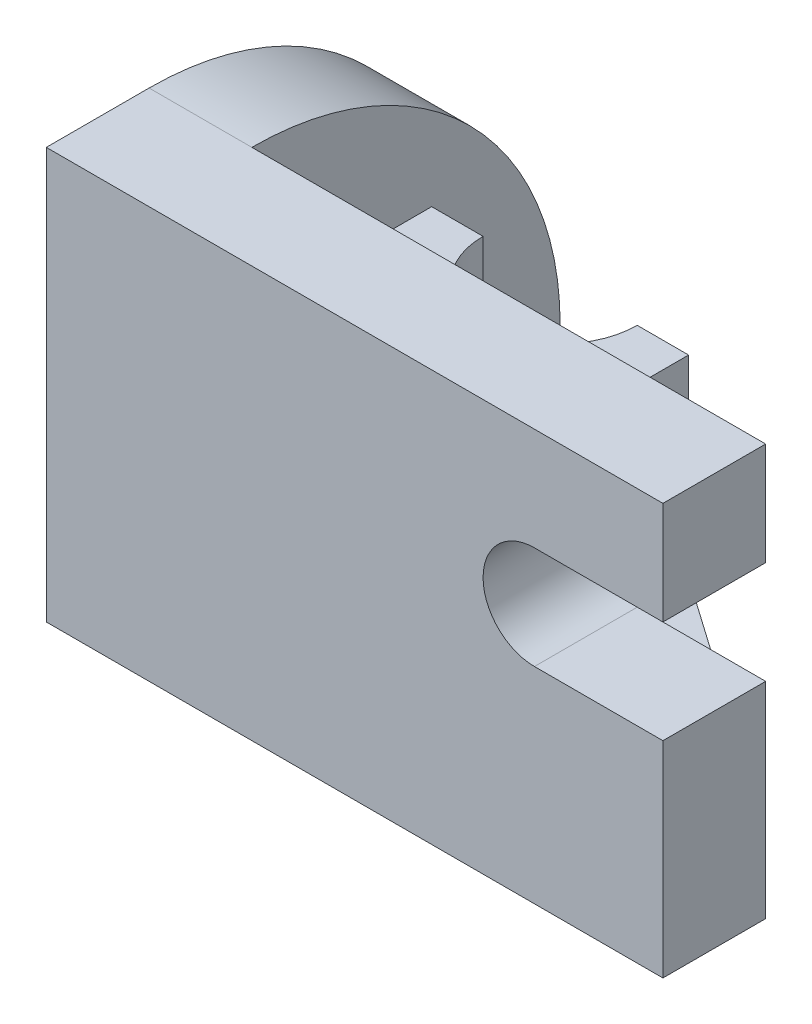
from build123d import *

# Parameters (mm, degrees)
SKETCH1_W           = 96
SKETCH1_H           = 64
BOSS_EXTRUDE1_DEPTH = 8
CUT_EXTRUDE1_DEPTH  = 60.866518188
SKETCH4_W           = 40
SKETCH4_H           = 28
BOSS_EXTRUDE2_DEPTH = 42
SKETCH5_R           = 12
CUT_EXTRUDE2_DEPTH  = 74.239333694
BOSS_EXTRUDE3_DEPTH = 12
BOSS_EXTRUDE4_DEPTH = 16


with BuildPart() as part:
    # Sketch1 → Boss-Extrude1 (new, symmetric)
    with BuildSketch(Plane.XY):
        Rectangle(SKETCH1_W, SKETCH1_H)
    extrude(amount=BOSS_EXTRUDE1_DEPTH, both=True)

    # Sketch2 → Cut-Extrude1 (cut, through all)
    with BuildSketch(Plane.XY.offset(8)):
        with BuildLine():
            Line((28, 0), (48, 0))
            Line((48, 0), (48, 16))
            Line((48, 16), (28, 16))
            ThreePointArc((28, 16), (33.656854249, 13.656854249), (36, 8))
            ThreePointArc((36, 8), (33.656854249, 2.343145751), (28, 0))
        make_face()
        with BuildLine():
            ThreePointArc((28, 16), (20, 8), (28, 0))
            Line((28, 0), (28, 16))
        make_face()
        with BuildLine():
            Line((28, 16), (28, 0))
            ThreePointArc((28, 0), (33.656854249, 2.343145751), (36, 8))
            ThreePointArc((36, 8), (33.656854249, 13.656854249), (28, 16))
        make_face()
    extrude(amount=-CUT_EXTRUDE1_DEPTH, mode=Mode.SUBTRACT)

    # Sketch4 → Boss-Extrude2 (add)
    with BuildSketch(Plane.XZ.offset(32)):
        with Locations((-12, -22)):
            Rectangle(SKETCH4_W, SKETCH4_H)
    extrude(amount=-BOSS_EXTRUDE2_DEPTH)

    # Sketch5 → Cut-Extrude2 (cut, through all)
    with BuildSketch(Plane(origin=(0, 10, 0), x_dir=(1, 0, 0), z_dir=(0, 1, 0))):
        with Locations((-12, 36)):
            Circle(SKETCH5_R)
    extrude(amount=-CUT_EXTRUDE2_DEPTH, mode=Mode.SUBTRACT)

    # Sketch6 → Boss-Extrude3 (add)
    with BuildSketch(Plane.XZ.offset(32)):
        Polygon((8, -36), (48, -8), (8, -8), align=None)
    extrude(amount=-BOSS_EXTRUDE3_DEPTH)

    # Sketch7 → Boss-Extrude4 (add)
    with BuildSketch(Plane.ZY.offset(48)):
        with BuildLine():
            Line((8, 32), (-8, 32))
            ThreePointArc((-8, 32), (-41.941125497, 17.941125497), (-56, -16))
            Line((-56, -16), (-56, -32))
            Line((-56, -32), (8, -32))
            Line((8, -32), (8, 32))
        make_face()
    extrude(amount=-BOSS_EXTRUDE4_DEPTH)


solid = part.part
